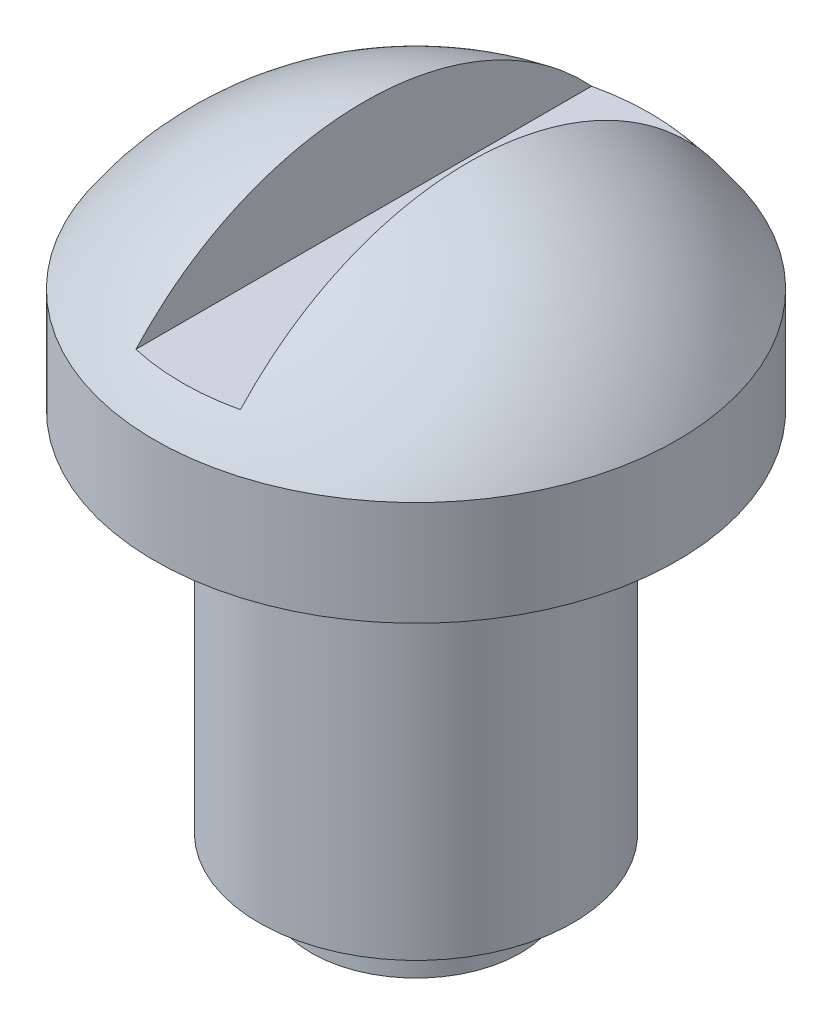
from build123d import *

# Parameters (mm, degrees)
SKETCH2_W          = 2
SKETCH2_H          = 4
CUT_EXTRUDE1_DEPTH = 5


with BuildPart() as part:
    # Sketch1 → Revolve1 (revolve)
    with BuildSketch(Plane.XY, mode=Mode.PRIVATE) as revolve1_sk:
        with BuildLine():
            Line((0, 0), (0, -12.68337521))
            Line((0, -12.68337521), (2, -12.68337521))
            Line((2, -12.68337521), (2, -11.68337521))
            Line((2, -11.68337521), (3, -11.68337521))
            Line((3, -11.68337521), (3, -4.68337521))
            Line((3, -4.68337521), (5, -4.68337521))
            Line((5, -4.68337521), (5, -2.68337521))
            ThreePointArc((5, -2.68337521), (2.837274331, -0.713235926), (0, 0))
        make_face()
    revolve(revolve1_sk.sketch.rotate(Axis((0, 0, 0), (0, -1, 0)), 180), axis=Axis((0, 0, 0), (0, -1, 0)))

    # Sketch2 → Cut-Extrude1 (cut, symmetric)
    with BuildSketch(Plane.XY):
        Rectangle(SKETCH2_W, SKETCH2_H)
    extrude(amount=CUT_EXTRUDE1_DEPTH, both=True, mode=Mode.SUBTRACT)


solid = part.part
